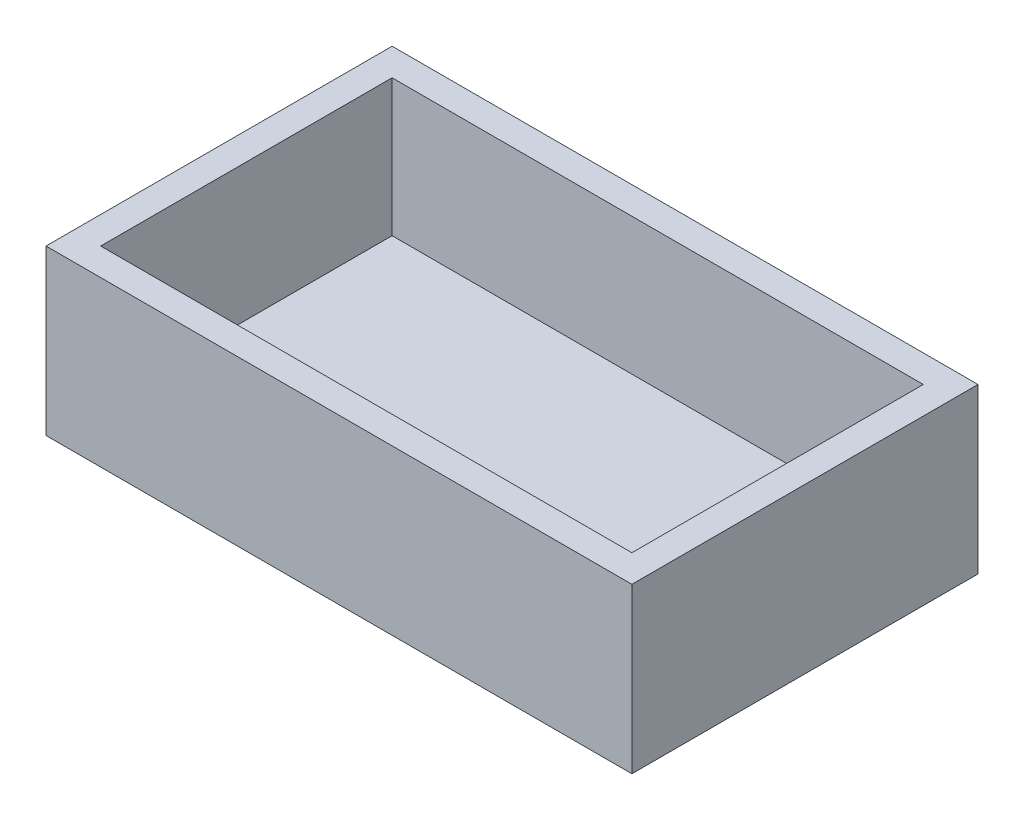
from build123d import *

# Parameters (mm, degrees)
ESQUISSE1_W        = 214.208867378
ESQUISSE1_H        = 126.538705932
BOSS_EXTRU_1_DEPTH = 60
COQUE2_T           = -10


with BuildPart() as part:
    # Esquisse1 → Boss.-Extru.1 (new body)
    with BuildSketch(Plane(origin=(0, 0, 0), x_dir=(1, 0, 0), z_dir=(0, 1, 0))):
        Rectangle(ESQUISSE1_W, ESQUISSE1_H)
    extrude(amount=BOSS_EXTRU_1_DEPTH)

    # Coque2
    coque2_openings = [part.faces().sort_by_distance(p)[0] for p in [
        (0, 60, 0),
    ]]
    offset(amount=COQUE2_T, openings=coque2_openings, kind=Kind.INTERSECTION)


solid = part.part
